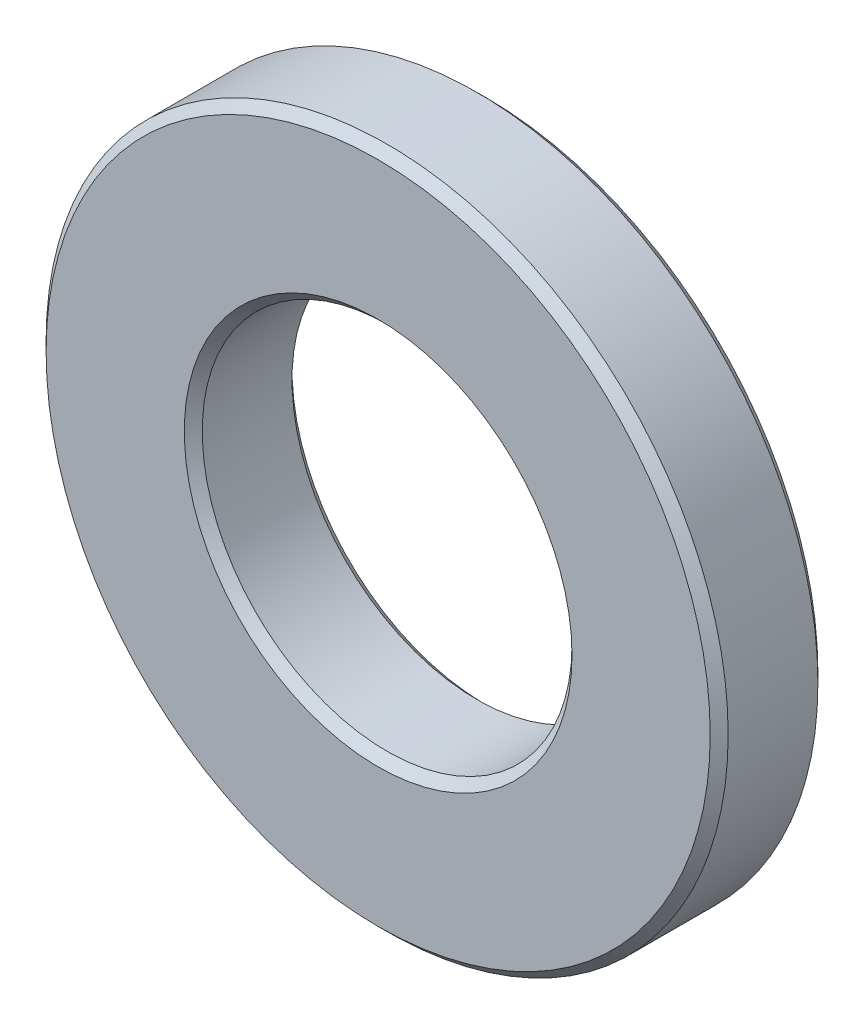
from build123d import *

# Parameters (mm, degrees)
SKETCH1_R      = 19
SKETCH1_R_2    = 10.3
EXTRUDE1_DEPTH = 6
CHAMFER1_SIZE  = 0.5


with BuildPart() as part:
    # Sketch1 → Extrude1 (new body)
    with BuildSketch(Plane.XY):
        Circle(SKETCH1_R)
        Circle(SKETCH1_R_2, mode=Mode.SUBTRACT)
    extrude(amount=EXTRUDE1_DEPTH)

    # Chamfer1
    chamfer1_edges = [part.edges().sort_by_distance(p)[0] for p in [
        (-19, 0, 0),
        (-19, 0, 6),
        (-10.3, 0, 0),
        (-10.3, 0, 6),
    ]]
    chamfer(chamfer1_edges, length=CHAMFER1_SIZE)


solid = part.part
